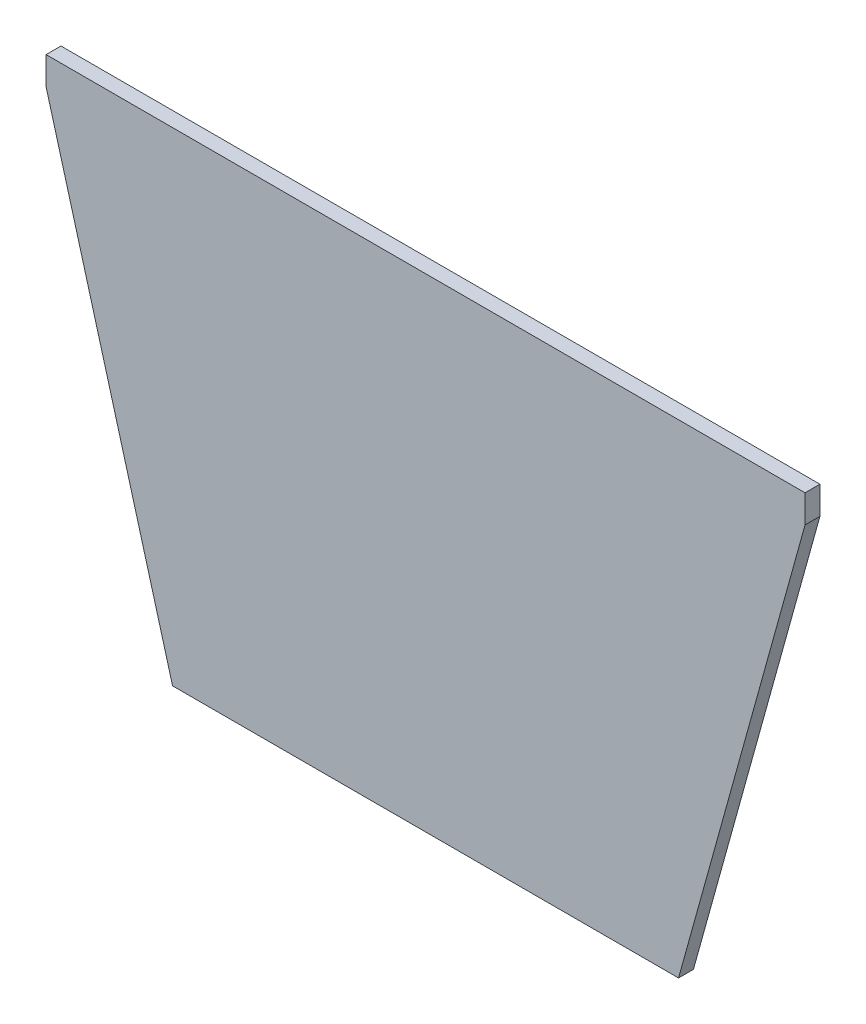
from build123d import *

# Parameters (mm, degrees)
BOSS_EXTRUDE1_DEPTH = 4


with BuildPart() as part:
    # Sketch1 → Boss-Extrude1 (new body)
    with BuildSketch(Plane.XY):
        Polygon((33.991, -4.08e-07), (169.971, -4.08e-07), (203.962, 122.427999592), (203.962, 129.927999592), (0, 129.927999592), (0, 122.427999592), align=None)
    extrude(amount=BOSS_EXTRUDE1_DEPTH)


solid = part.part
